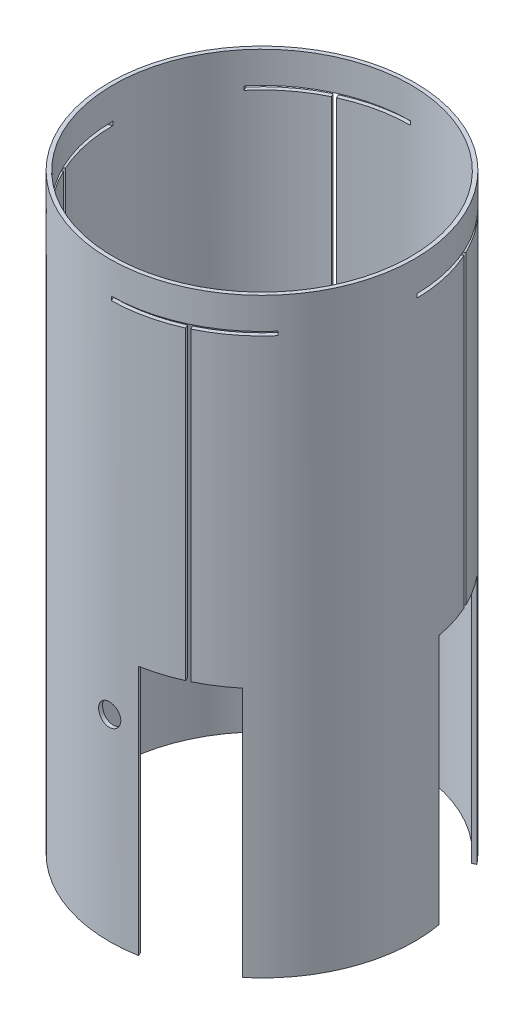
from build123d import *

# Parameters (mm, degrees)
CUT_EXTRUDE1_DEPTH      = 256.209705365
CUT_EXTRUDE1_DEPTH_BACK = 256.209705365
SKETCH2_R               = 4.5
CUT_EXTRUDE2_DEPTH      = 256.209705507
CIRPATTERN1_COUNT       = 4


with BuildPart() as part:
    # Sketch1 → Revolve1 (revolve)
    with BuildSketch(Plane.XY, mode=Mode.PRIVATE) as revolve1_sk:
        Polygon((-60.325, 239.72), (-60.325, 238.1325), (-60.325, 0), (-61.9125, 0), (-61.9125, 239.72), align=None)
    revolve(revolve1_sk.sketch.rotate(Axis((0, 0, 0), (0, 1, 0)), 270), axis=Axis((0, 0, 0), (0, 1, 0)))

    # Sketch2 → Cut-Extrude1 (cut, two sides: drawn at the far end of the back side and taken through both)
    with BuildSketch(Plane.XY.offset(-CUT_EXTRUDE1_DEPTH_BACK)):
        with Locations((0, 79.7)):
            Circle(SKETCH2_R)
    extrude(amount=CUT_EXTRUDE1_DEPTH + CUT_EXTRUDE1_DEPTH_BACK, mode=Mode.SUBTRACT)

    # Sketch3 → Cut-Extrude2 (cut, through all)
    with BuildSketch(Plane(origin=(0, 0, 0), x_dir=(0.906307787036651, 0, -0.4226182617406972), z_dir=(0.4226182617406972, 0, 0.906307787036651))):
        Polygon((-15.875, 0), (-15.875, 101.6), (-0.79375, 101.6), (-0.79375, 225.4325), (-25.4, 225.4325), (-25.4, 227.02), (25.4, 227.02), (25.4, 225.4325), (0.79375, 225.4325), (0.79375, 101.6), (15.875, 101.6), (15.875, 0), align=None)
    cut_extrude2 = extrude(amount=-CUT_EXTRUDE2_DEPTH, mode=Mode.SUBTRACT)

    # CirPattern1: Cut-Extrude2 ×4 about axis
    cirpattern1_axis = Axis((0, 0, 0), (0, 1, 0))
    for i in range(1, CIRPATTERN1_COUNT):
        add(cut_extrude2.rotate(cirpattern1_axis, i * 360 / CIRPATTERN1_COUNT), mode=Mode.SUBTRACT)


solid = part.part
